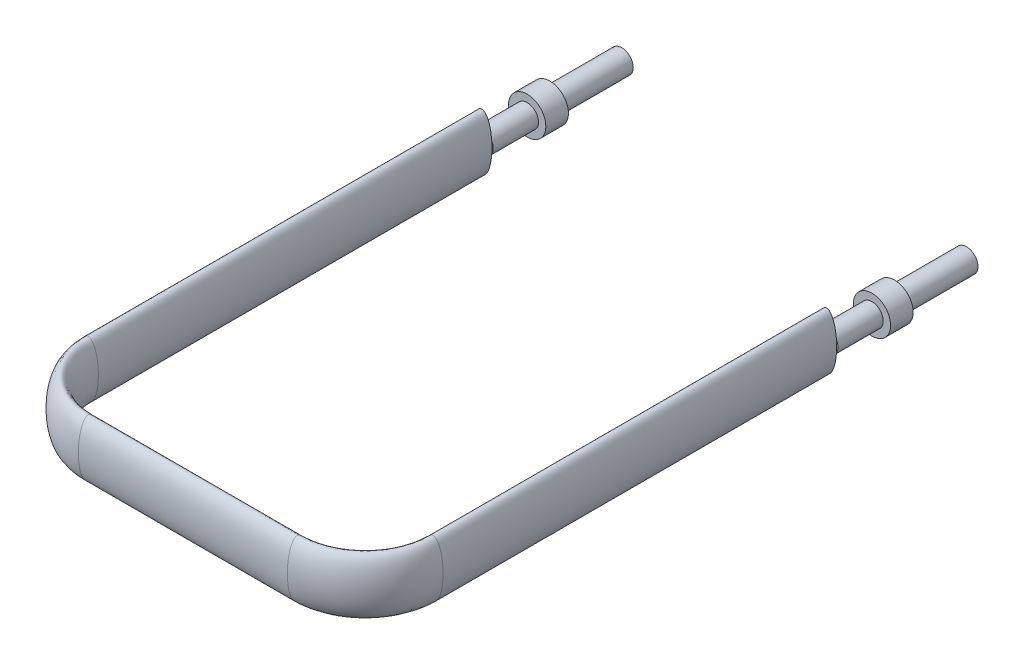
from build123d import *

# Parameters (mm, degrees)
SKETCH1_R             = 0.51
BOSS_EXTRUDE1_DEPTH   = 3.18
BOSS_EXTRUDE1_2_DEPTH = 3.18
SKETCH2_R             = 0.825
BOSS_EXTRUDE2_DEPTH   = 1
SKETCH3_R             = 0.5
BOSS_EXTRUDE3_DEPTH   = 2
SKETCH5_RX            = 1.25
SKETCH5_RY            = 0.444386005


with BuildPart() as part:
    # Sketch1 → Boss-Extrude1 (new body)
    with BuildSketch(Plane.XY):
        with Locations((-7.62, 0)):
            Circle(SKETCH1_R)
    extrude(amount=-BOSS_EXTRUDE1_DEPTH)



with BuildPart() as body_2:
    # Sketch1 → Boss-Extrude1 2 (new body)
    with BuildSketch(Plane.XY):
        with Locations((7.62, 0)):
            Circle(SKETCH1_R)
    extrude(amount=-BOSS_EXTRUDE1_2_DEPTH)


with BuildPart() as part_1:
    add(part.part)

    add(body_2.part)  # Boss-Extrude2 merges body 2
    # Sketch2 → Boss-Extrude2 (add)
    with BuildSketch(Plane.XY):
        with Locations((-7.62, 0)):
            Circle(SKETCH2_R)
        with Locations((7.62, 0)):
            Circle(SKETCH2_R)
    extrude(amount=BOSS_EXTRUDE2_DEPTH)

    # Sketch3 → Boss-Extrude3 (add)
    with BuildSketch(Plane.XY.offset(1)):
        with Locations((-7.62, 0)):
            Circle(SKETCH3_R)
        with Locations((7.62, 0)):
            Circle(SKETCH3_R)
    extrude(amount=BOSS_EXTRUDE3_DEPTH)

    # Sweep1: sweep along a path in Sketch4
    with BuildLine(Plane(origin=(0, 0, 0), x_dir=(1, 0, 0), z_dir=(0, 1, 0))) as sweep1_path:
        Line((-7.62, -3), (-7.62, -20.4))
        ThreePointArc((-7.62, -20.4), (-6.741320344, -22.521320344), (-4.62, -23.4))
        Line((-4.62, -23.4), (4.62, -23.4))
        ThreePointArc((4.62, -23.4), (6.741320344, -22.521320344), (7.62, -20.4))
        Line((7.62, -20.4), (7.62, -3))
    # Sketch5 → Sweep1 (sweep)
    with BuildSketch(Plane.XY.offset(3)):
        with Locations(Location((-7.62, 0), (0, 0, -90))):
            Ellipse(SKETCH5_RX, SKETCH5_RY)
    sweep(path=sweep1_path.line)


solid = part_1.part
